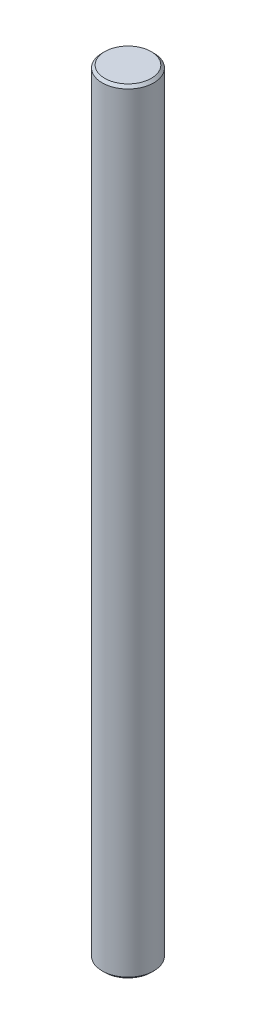
from build123d import *

# Parameters (mm, degrees)
SKETCH1_R           = 2.5
BOSS_EXTRUDE1_DEPTH = 37.5
CHAMFER1_SIZE       = 0.25


with BuildPart() as part:
    # Sketch1 → Boss-Extrude1 (new, symmetric)
    with BuildSketch(Plane(origin=(0, 0, 0), x_dir=(1, 0, 0), z_dir=(0, 1, 0))):
        with Locations(Location((0, 0, 0), (0, 0, 270))):
            Circle(SKETCH1_R)
    extrude(amount=BOSS_EXTRUDE1_DEPTH, both=True)

    # Chamfer1
    chamfer1_edges = [part.edges().sort_by_distance(p)[0] for p in [
        (0, -37.5, -2.5),
        (0, 37.5, -2.5),
    ]]
    chamfer(chamfer1_edges, length=CHAMFER1_SIZE)


solid = part.part
